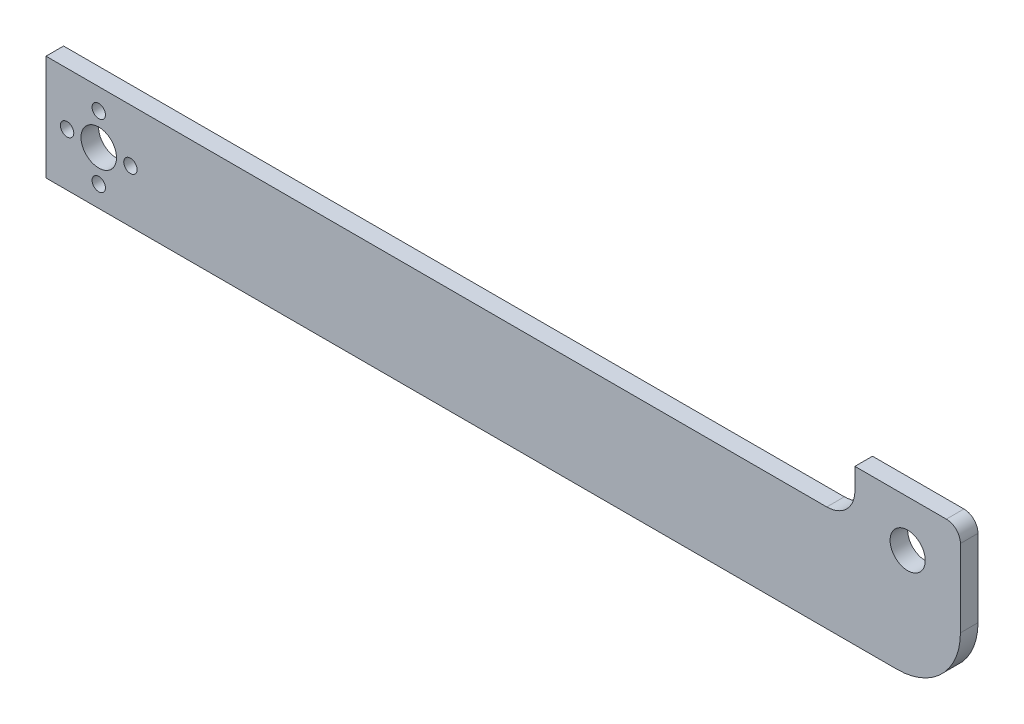
from build123d import *

# Parameters (mm, degrees)
SKETCH1_R           = 6.4135
SKETCH1_R_2         = 2.413
SKETCH1_R_3         = 6.35
BOSS_EXTRUDE1_DEPTH = 6.35
FILLET1_R           = 5.08


with BuildPart() as part:
    # Sketch1 → Boss-Extrude1 (new body)
    with BuildSketch(Plane.XY):
        with BuildLine():
            Line((273.05, 36.83), (273.05, 29.21))
            ThreePointArc((273.05, 29.21), (270.074204897, 22.025795103), (262.89, 19.05))
            Line((262.89, 19.05), (-19.05, 19.05))
            Line((-19.05, 19.05), (-19.05, -19.05))
            Line((-19.05, -19.05), (285.190051277, -19.05))
            Line((285.190051277, -19.05), (288.29, -19.05))
            ThreePointArc((288.29, -19.05), (304.454461018, -12.354461018), (311.15, 3.81))
            Line((311.15, 3.81), (311.15, 36.83))
            Line((311.15, 36.83), (273.05, 36.83))
        make_face()
        Circle(SKETCH1_R, mode=Mode.SUBTRACT)
        with Locations((0, 11.43)):
            Circle(SKETCH1_R_2, mode=Mode.SUBTRACT)
        with Locations((11.43, 0)):
            Circle(SKETCH1_R_2, mode=Mode.SUBTRACT)
        with Locations((0, -11.43)):
            Circle(SKETCH1_R_2, mode=Mode.SUBTRACT)
        with Locations((-11.43, 0)):
            Circle(SKETCH1_R_2, mode=Mode.SUBTRACT)
        with Locations((292.1, 20.066)):
            Circle(SKETCH1_R_3, mode=Mode.SUBTRACT)
    extrude(amount=BOSS_EXTRUDE1_DEPTH)

    # Fillet1
    fillet1_edges = [part.edges().sort_by_distance(p)[0] for p in [
        (311.15, 36.83, 3.175),
    ]]
    fillet(fillet1_edges, radius=FILLET1_R)


solid = part.part
